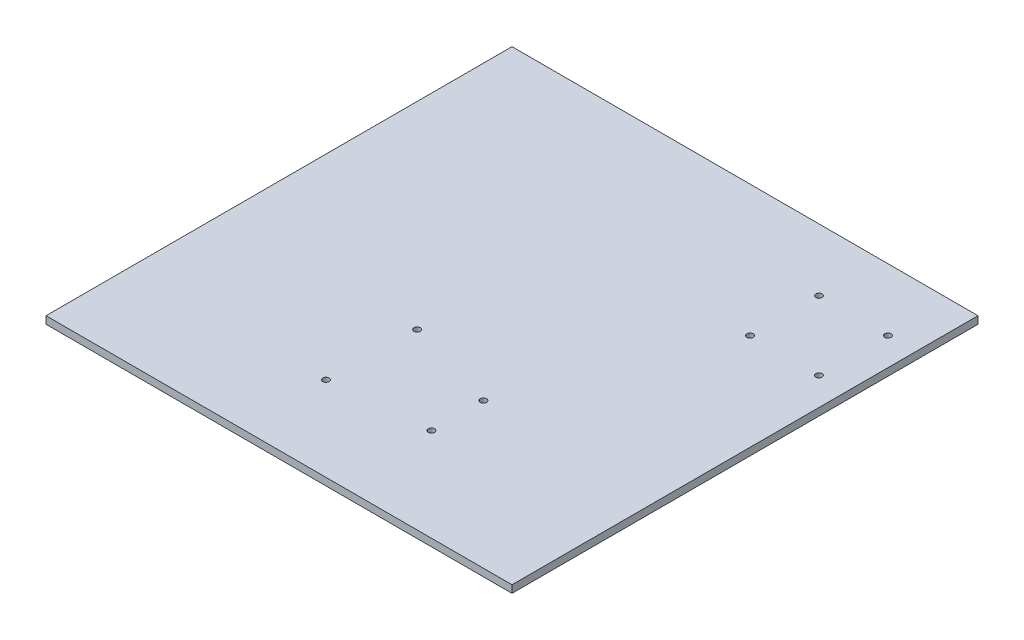
from build123d import *

# Parameters (mm, degrees)
SKETCH1_W           = 250
SKETCH1_H           = 250
BOSS_EXTRUDE1_DEPTH = 4
SKETCH3_R           = 1.7
CUT_EXTRUDE1_DEPTH  = 4


with BuildPart() as part:
    # Sketch1 → Boss-Extrude1 (new body)
    with BuildSketch(Plane(origin=(0, 0, 0), x_dir=(1, 0, 0), z_dir=(0, 1, 0))):
        with Locations((0.82781457, -32.698675497)):
            Rectangle(SKETCH1_W, SKETCH1_H)
    extrude(amount=BOSS_EXTRUDE1_DEPTH)

    # Sketch3 → Cut-Extrude1 (cut)
    with BuildSketch(Plane(origin=(0, 4, 0), x_dir=(1, 0, 0), z_dir=(0, 1, 0))):
        with Locations(Location((-18.21218543, -64.588675497, 0), (0, 0, 270))):
            Circle(SKETCH3_R)
        with Locations(Location((-19.31218543, -112.388675497, 0), (0, 0, 270))):
            Circle(SKETCH3_R)
        with Locations(Location((32.58781457, -79.788675497, 0), (0, 0, 270))):
            Circle(SKETCH3_R)
        with Locations(Location((32.58781457, -107.688675497, 0), (0, 0, 270))):
            Circle(SKETCH3_R)
        with Locations(Location((73.887070129, 21.937056584, 0), (0, 0, 270))):
            Circle(SKETCH3_R)
        with Locations(Location((73.887070129, 58.937056584, 0), (0, 0, 270))):
            Circle(SKETCH3_R)
        with Locations(Location((110.887070129, 21.937056584, 0), (0, 0, 270))):
            Circle(SKETCH3_R)
        with Locations(Location((110.887070129, 58.937056584, 0), (0, 0, 270))):
            Circle(SKETCH3_R)
    extrude(amount=-CUT_EXTRUDE1_DEPTH, mode=Mode.SUBTRACT)


solid = part.part
